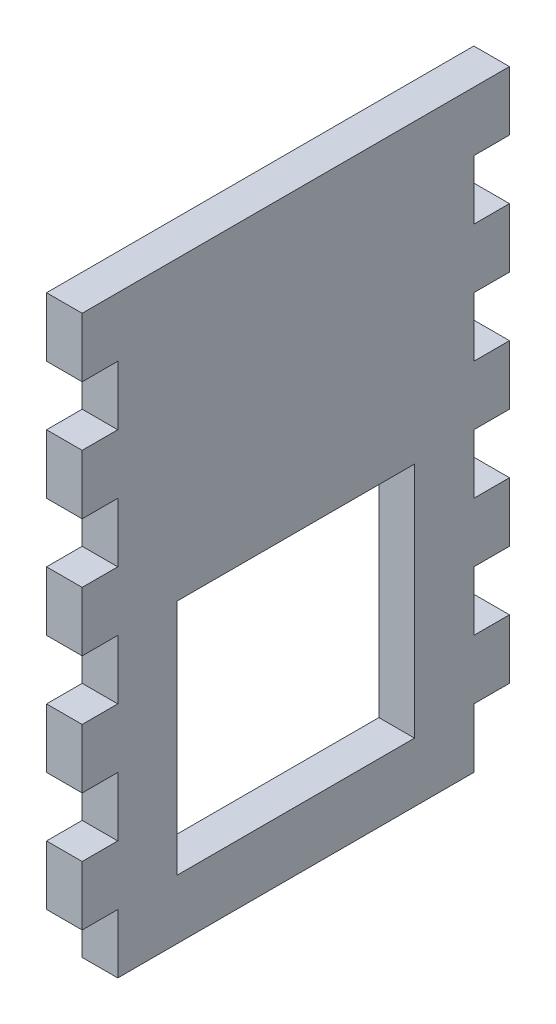
from build123d import *

# Parameters (mm, degrees)
ESBO_O1_W                = 20
ESBO_O1_H                = 20
RESSALTO_EXTRUS_O1_DEPTH = 3


with BuildPart() as part:
    # Esboço1 → Ressalto-extrusão1 (new body)
    with BuildSketch(Plane(origin=(0, 0, 0), x_dir=(0, 0, -1), z_dir=(1, 0, 0))):
        Polygon((-18.496900578, 22.479218088), (-18.496900578, 17.479218088), (-15.496900578, 17.479218088), (-15.496900578, 12.479218088), (-18.496900578, 12.479218088), (-18.496900578, 7.479218088), (-15.496900578, 7.479218088), (-15.496900578, 2.479218088), (-18.496900578, 2.479218088), (-18.496900578, -2.520781912), (-15.496900578, -2.520781912), (-15.496900578, -7.520781912), (-18.496900578, -7.520781912), (-18.496900578, -12.520781912), (-15.496900578, -12.520781912), (-15.496900578, -17.520781912), (-18.496900578, -17.520781912), (-18.496900578, -22.520781912), (-15.496900578, -22.520781912), (-15.496900578, -27.520781912), (14.503099422, -27.520781912), (14.503099422, -22.520781912), (17.503099422, -22.520781912), (17.503099422, -17.520781912), (14.503099422, -17.520781912), (14.503099422, -12.520781912), (17.503099422, -12.520781912), (17.503099422, -7.520781912), (14.503099422, -7.520781912), (14.503099422, -2.520781912), (17.503099422, -2.520781912), (17.503099422, 2.479218088), (14.503099422, 2.479218088), (14.503099422, 7.479218088), (17.503099422, 7.479218088), (17.503099422, 12.479218088), (14.503099422, 12.479218088), (14.503099422, 17.479218088), (17.503099422, 17.479218088), (17.503099422, 22.479218088), align=None)
        with Locations((-0.496900578, -12.520781912)):
            Rectangle(ESBO_O1_W, ESBO_O1_H, mode=Mode.SUBTRACT)
    extrude(amount=RESSALTO_EXTRUS_O1_DEPTH)


solid = part.part
